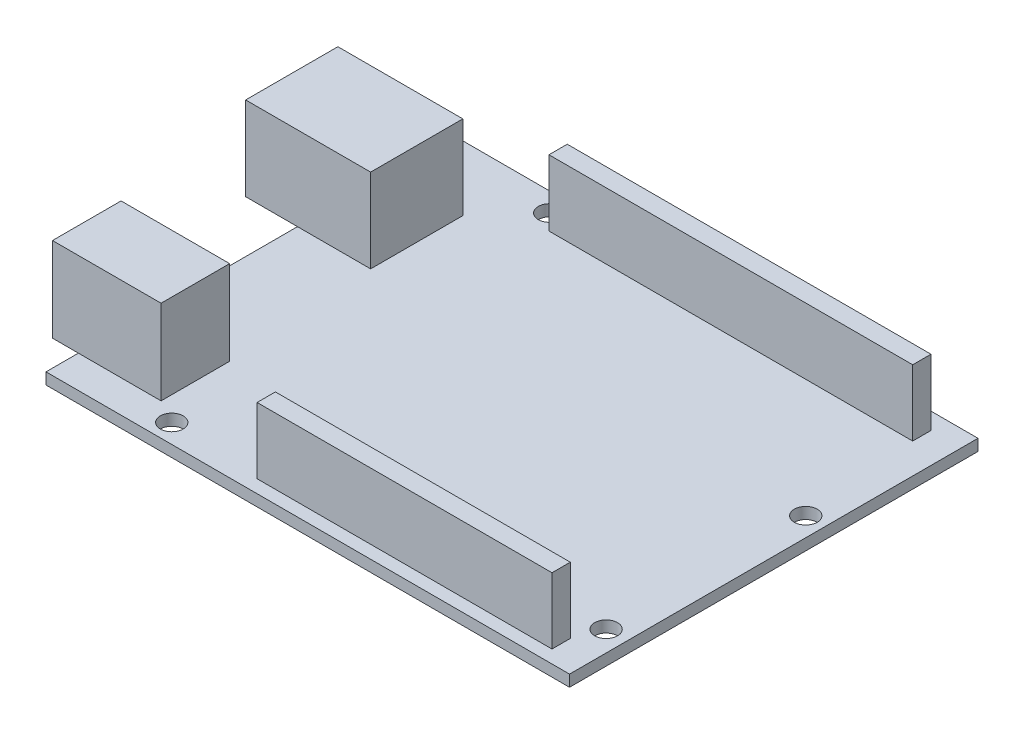
from build123d import *

# Parameters (mm, degrees)
SKETCH2_W                 = 68.7
SKETCH2_H                 = 53.6
PCB_DEPTH                 = 1.5
BARREL_START              = 1.5
SKETCH3_W                 = 14.25
SKETCH3_H                 = 9
BARREL_JACK_DEPTH         = 11.1
HWSERIAL_START            = 1.5
SKETCH4_W                 = 16.4
SKETCH4_H                 = 12.1
HWSERIAL_PORT_DEPTH       = 11
BOSS_EXTRUDE4_START       = 1.5
SKETCH5_W                 = 47.73
SKETCH5_H                 = 2.4
SKETCH5_W_2               = 38.7
BOSS_EXTRUDE4_DEPTH       = 8.67
F_3_0MM_DOWEL_HOLE1_D     = 3
F_3_0MM_DOWEL_HOLE1_DEPTH = 7.5
F_3_0MM_DOWEL_HOLE1_TIP   = 0.901290929


with BuildPart() as part:
    # Sketch2 → PCB (new body)
    with BuildSketch(Plane(origin=(0, 0, 0), x_dir=(1, 0, 0), z_dir=(0, 1, 0))):
        with Locations((34.35, 26.8)):
            Rectangle(SKETCH2_W, SKETCH2_H)
    extrude(amount=PCB_DEPTH)

    # Sketch3 → Barrel Jack (add)
    with BuildSketch(Plane(origin=(0, 0, 0), x_dir=(1, 0, 0), z_dir=(0, 1, 0)).offset(BARREL_START)):
        with Locations((3.725, 8.75)):
            Rectangle(SKETCH3_W, SKETCH3_H)
    extrude(amount=BARREL_JACK_DEPTH)

    # Sketch4 → HWSerial Port (add)
    with BuildSketch(Plane(origin=(0, 0, 0), x_dir=(1, 0, 0), z_dir=(0, 1, 0)).offset(HWSERIAL_START)):
        with Locations((1.4, 39.05)):
            Rectangle(SKETCH4_W, SKETCH4_H)
    extrude(amount=HWSERIAL_PORT_DEPTH)

    # Sketch5 → Boss-Extrude4 (add)
    with BuildSketch(Plane(origin=(0, 0, 0), x_dir=(1, 0, 0), z_dir=(0, 1, 0)).offset(BOSS_EXTRUDE4_START)):
        with Locations((40.865, 50.2)):
            Rectangle(SKETCH5_W, SKETCH5_H)
        with Locations((45.35, 2.9)):
            Rectangle(SKETCH5_W_2, SKETCH5_H)
    extrude(amount=BOSS_EXTRUDE4_DEPTH)

    # Ø3.0mm Dowel Hole1
    with Locations(Plane(origin=(0, 1.5, 0), x_dir=(1, 0, 0), z_dir=(0, 1, 0))):
        with Locations((15, 51.1), (14, 2.5), (66, 7.5), (66.2, 33.5)):
            Hole(F_3_0MM_DOWEL_HOLE1_D / 2, depth=F_3_0MM_DOWEL_HOLE1_DEPTH)
            with Locations((0, 0, -(F_3_0MM_DOWEL_HOLE1_DEPTH + F_3_0MM_DOWEL_HOLE1_TIP / 2))):  # 118° drill point
                Cone(0, F_3_0MM_DOWEL_HOLE1_D / 2, F_3_0MM_DOWEL_HOLE1_TIP, mode=Mode.SUBTRACT)


solid = part.part
